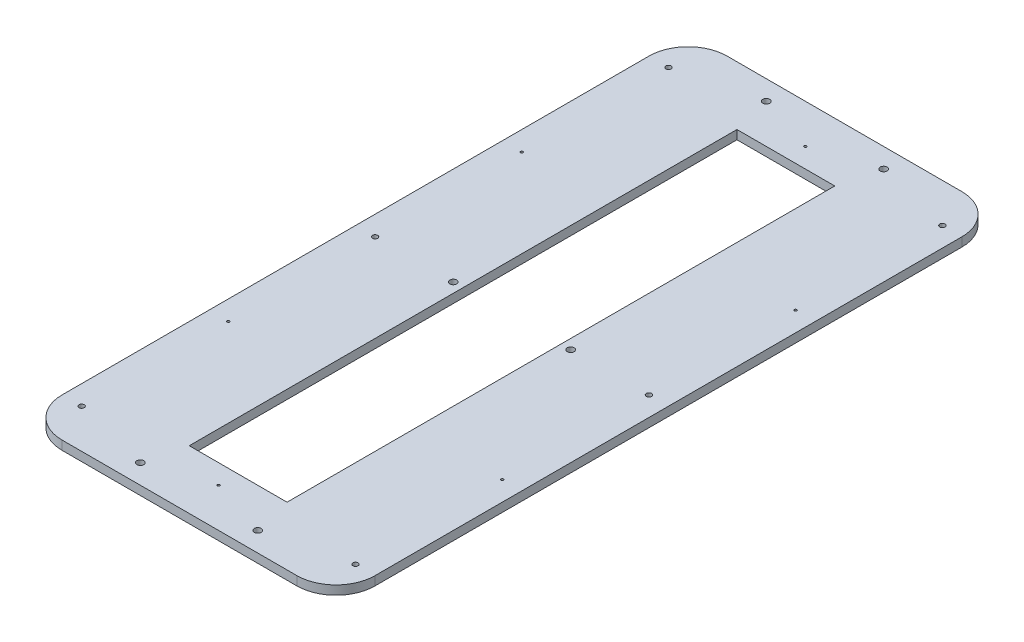
from build123d import *

# Parameters (mm, degrees)
SKETCH1_W                = 203.2
SKETCH1_H                = 431.8
BOSS_EXTRUDE1_DEPTH      = 5.8
M4_CLEARANCE_HOLE1_D     = 4.5
M4_CLEARANCE_HOLE1_DEPTH = 12.7
M4_CLEARANCE_HOLE1_TIP   = 1.351936393
SKETCH7_W                = 63.5
SKETCH7_H                = 355.6
CUT_EXTRUDE2_DEPTH       = 478.257917692
FILLET1_R                = 25.4
M3_CLEARANCE_HOLE1_D     = 3.4
M3_CLEARANCE_HOLE1_DEPTH = 12.7
M3_CLEARANCE_HOLE1_TIP   = 1.021463052
SKETCH10_R               = 0.79375
CUT_EXTRUDE3_DEPTH       = 478.257917692


with BuildPart() as part:
    # Sketch1 → Boss-Extrude1 (new body)
    with BuildSketch(Plane(origin=(0, 0, 0), x_dir=(1, 0, 0), z_dir=(0, 1, 0))):
        with Locations((101.6, 215.9)):
            Rectangle(SKETCH1_W, SKETCH1_H)
    extrude(amount=BOSS_EXTRUDE1_DEPTH)

    # M4 Clearance Hole1
    with Locations(Plane(origin=(0, 5.8, 0), x_dir=(-1, 0, 0), z_dir=(0, 1, 0))):
        with Locations((-63.5, -419.1), (-139.7, -419.1), (-63.5, -215.9), (-139.7, -215.9), (-63.5, -12.7), (-139.7, -12.7)):
            Hole(M4_CLEARANCE_HOLE1_D / 2, depth=M4_CLEARANCE_HOLE1_DEPTH)
            with Locations((0, 0, -(M4_CLEARANCE_HOLE1_DEPTH + M4_CLEARANCE_HOLE1_TIP / 2))):  # 118° drill point
                Cone(0, M4_CLEARANCE_HOLE1_D / 2, M4_CLEARANCE_HOLE1_TIP, mode=Mode.SUBTRACT)

    # Sketch7 → Cut-Extrude2 (cut, through all)
    with BuildSketch(Plane(origin=(0, 5.8, 0), x_dir=(1, 0, 0), z_dir=(0, 1, 0))):
        with Locations((101.6, 215.9)):
            Rectangle(SKETCH7_W, SKETCH7_H)
    extrude(amount=-CUT_EXTRUDE2_DEPTH, mode=Mode.SUBTRACT)

    # Fillet1
    fillet1_edges = [part.edges().sort_by_distance(p)[0] for p in [
        (0, 2.9, -431.8),
        (203.2, 2.9, -431.8),
        (203.2, 2.9, 0),
        (0, 2.9, 0),
    ]]
    fillet(fillet1_edges, radius=FILLET1_R)

    # M3 Clearance Hole1
    with Locations(Plane(origin=(0, 5.8, 0), x_dir=(-1, 0, 0), z_dir=(0, 1, 0))):
        with Locations((-190.5, -406.4), (-190.5, -25.4), (-12.7, -25.4), (-12.7, -406.4), (-190.5, -215.9), (-12.7, -215.9)):
            Hole(M3_CLEARANCE_HOLE1_D / 2, depth=M3_CLEARANCE_HOLE1_DEPTH)
            with Locations((0, 0, -(M3_CLEARANCE_HOLE1_DEPTH + M3_CLEARANCE_HOLE1_TIP / 2))):  # 118° drill point
                Cone(0, M3_CLEARANCE_HOLE1_D / 2, M3_CLEARANCE_HOLE1_TIP, mode=Mode.SUBTRACT)

    # Sketch10 → Cut-Extrude3 (cut, through all)
    with BuildSketch(Plane(origin=(0, 5.8, 0), x_dir=(-1, 0, 0), z_dir=(0, 1, 0))):
        with Locations(Location((-190.5, -120.65, 0), (0, 0, 90))):
            Circle(SKETCH10_R)
        with Locations(Location((-12.7, -120.65, 0), (0, 0, 90))):
            Circle(SKETCH10_R)
        with Locations(Location((-101.6, -25.4, 0), (0, 0, 90))):
            Circle(SKETCH10_R)
        with Locations(Location((-101.6, -406.4, 0), (0, 0, 270))):
            Circle(SKETCH10_R)
        with Locations(Location((-12.7, -311.15, 0), (0, 0, 270))):
            Circle(SKETCH10_R)
        with Locations(Location((-190.5, -311.15, 0), (0, 0, 270))):
            Circle(SKETCH10_R)
    extrude(amount=-CUT_EXTRUDE3_DEPTH, mode=Mode.SUBTRACT)


solid = part.part
